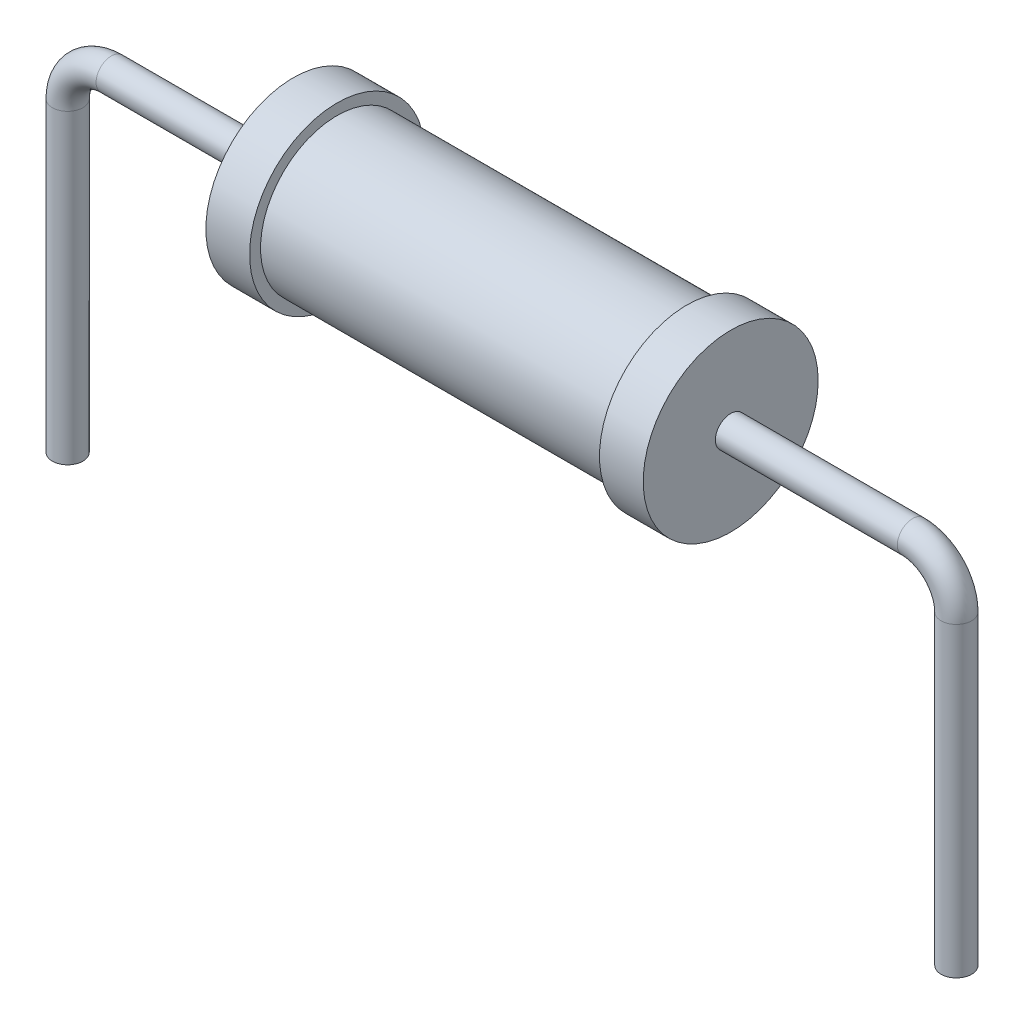
from build123d import *

# Parameters (mm, degrees)
SKETCH_1_R          = 2
EXTRUDE_1_DEPTH     = 5
SKETCH_2_R          = 0.35
SKETCH_5_R          = 2.75
SKETCH_5_R_2        = 1.75
CUT_EXTRUDE_1_DEPTH = 4


with BuildPart() as part:
    # Эскиз1 → Бобышка-Вытянуть1 (new body)
    with BuildSketch(Plane(origin=(0, 0, 0), x_dir=(0, 0, -1), z_dir=(1, 0, 0))):
        Circle(SKETCH_1_R)
    extrude_1 = extrude(amount=EXTRUDE_1_DEPTH)

    # По траектории1: sweep along a path in Эскиз3
    with BuildLine(Plane.XY) as sweep_1_path:
        Line((5, 0), (9.16, 0))
        ThreePointArc((9.16, 0), (9.867106781, -0.292893219), (10.16, -1))
        Line((10.16, -1), (10.16, -8))
    # Эскиз2 → По траектории1 (sweep)
    with BuildSketch(Plane(origin=(5, 0, 0), x_dir=(0, 0, -1), z_dir=(1, 0, 0))):
        Circle(SKETCH_2_R)
    sweep_1 = sweep(path=sweep_1_path.line)

    # Зеркальное отражение1: Бобышка-Вытянуть1, По траектории1 across Right Plane
    add(extrude_1.mirror(Plane(origin=(0, 0, 0), x_dir=(0, 0, -1), z_dir=(1, 0, 0))))
    add(sweep_1.mirror(Plane(origin=(0, 0, 0), x_dir=(0, 0, -1), z_dir=(1, 0, 0))))

    # Эскиз5 → Вырез-Вытянуть-Тонкостенный1 (cut, symmetric)
    with BuildSketch(Plane(origin=(0, 0, 0), x_dir=(0, 0, -1), z_dir=(1, 0, 0))):
        Circle(SKETCH_5_R)
        Circle(SKETCH_5_R_2, mode=Mode.SUBTRACT)
    extrude(amount=CUT_EXTRUDE_1_DEPTH, both=True, mode=Mode.SUBTRACT)


solid = part.part
